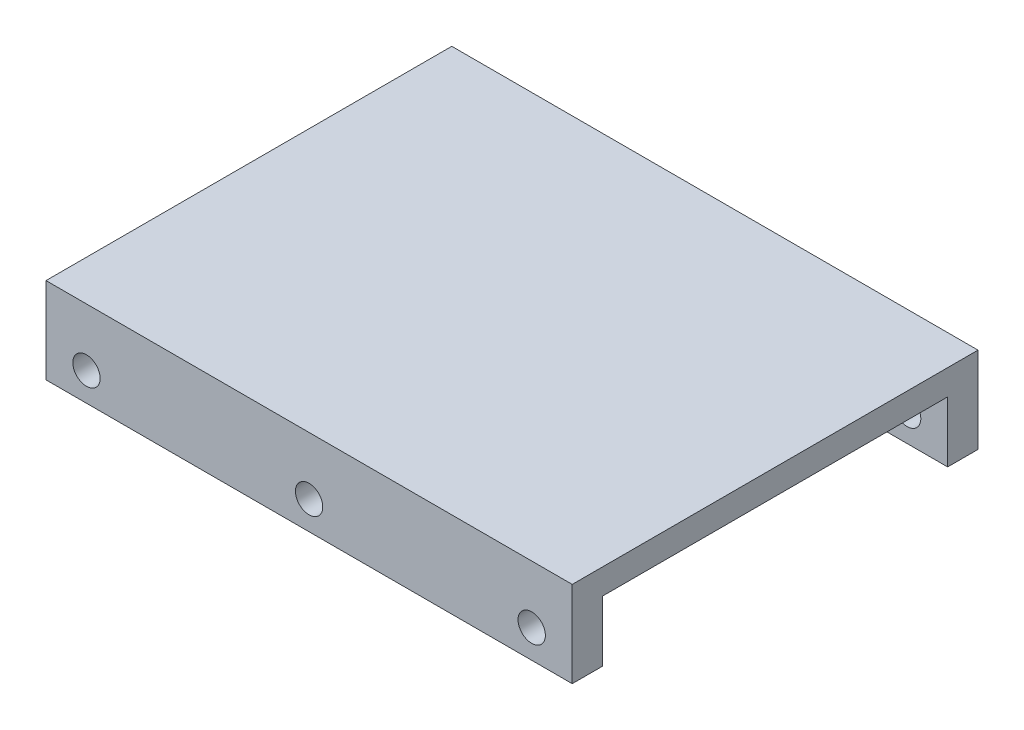
from build123d import *

# Parameters (mm, degrees)
BOSS_EXTRUDE1_DEPTH = 40.1
SKETCH3_R           = 1.35
CUT_EXTRUDE2_DEPTH  = 50.8
SKETCH4_R           = 1.016
CUT_EXTRUDE3_DEPTH  = 50.8
SKETCH6_W           = 62.086073973
SKETCH6_H           = 34.1
CUT_EXTRUDE4_DEPTH  = 6
SKETCH17_W          = 33.483743456
SKETCH17_H          = 71.762692688
CUT_EXTRUDE5_DEPTH  = 101.73954578


with BuildPart() as part:
    # Sketch1 → Boss-Extrude1 (new body)
    with BuildSketch(Plane.XY):
        Polygon((0, 0), (0, 52.578), (6, 52.578), (6, 8.5), (76, 8.5), (76, 0), align=None)
    extrude(amount=BOSS_EXTRUDE1_DEPTH)

    # Sketch3 → Cut-Extrude2 (cut)
    with BuildSketch(Plane.XY.offset(40.1)):
        with Locations((27.996, 2.8)):
            Circle(SKETCH3_R)
        with Locations((49.996, 2.8)):
            Circle(SKETCH3_R)
        with Locations((71.996, 2.8)):
            Circle(SKETCH3_R)
    extrude(amount=-CUT_EXTRUDE2_DEPTH, mode=Mode.SUBTRACT)

    # Sketch4 → Cut-Extrude3 (cut)
    with BuildSketch(Plane.ZY):
        with Locations((27.88, 17.6)):
            Circle(SKETCH4_R)
        with Locations(Location((11.88, 17.6, 0), (0, 0, 270))):
            Circle(SKETCH4_R)
        with Locations((27.88, 49.6)):
            Circle(SKETCH4_R)
        with Locations(Location((11.88, 49.6, 0), (0, 0, 270))):
            Circle(SKETCH4_R)
    extrude(amount=-CUT_EXTRUDE3_DEPTH, mode=Mode.SUBTRACT)

    # Sketch6 → Cut-Extrude4 (cut)
    with BuildSketch(Plane.XZ):
        with Locations((50.043036987, 20.05)):
            Rectangle(SKETCH6_W, SKETCH6_H)
    extrude(amount=-CUT_EXTRUDE4_DEPTH, mode=Mode.SUBTRACT)

    # Sketch17 → Cut-Extrude5 (cut, through all)
    with BuildSketch(Plane.XY.offset(40.1)):
        with Locations((7.254128272, 35.881346344)):
            Rectangle(SKETCH17_W, SKETCH17_H)
    extrude(amount=-CUT_EXTRUDE5_DEPTH, mode=Mode.SUBTRACT)


solid = part.part
